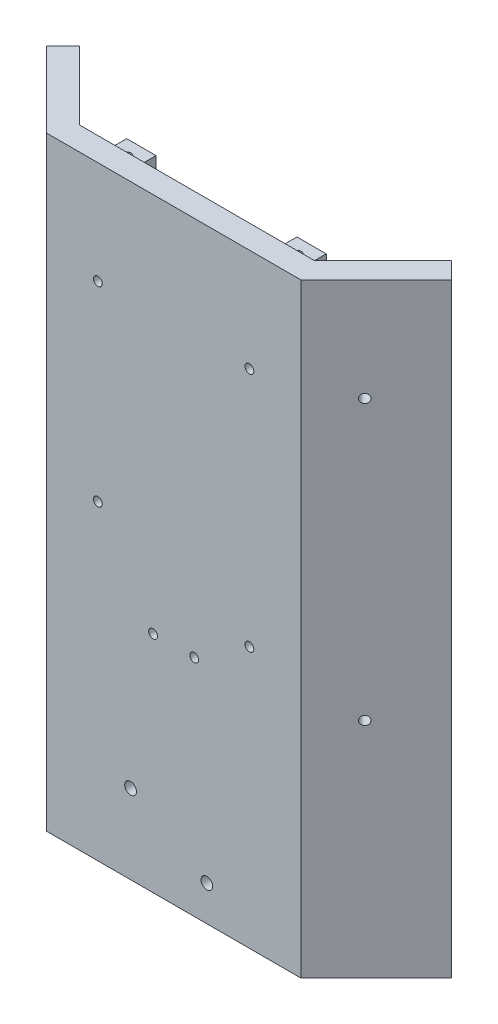
from build123d import *

# Parameters (mm, degrees)
BOSS_EXTRUDE1_DEPTH = 206
SKETCH2_W           = 10
SKETCH2_H           = 6
BOSS_EXTRUDE2_DEPTH = 10
CUT_EXTRUDE1_REACH  = 214.848
SKETCH3_R           = 1.5
CUT_EXTRUDE2_REACH  = 221.494
SKETCH4_R           = 2
CUT_EXTRUDE3_REACH  = 221.494
SKETCH5_R           = 1.5
CUT_EXTRUDE4_REACH  = 221.494
SKETCH6_R           = 1.5
CUT_EXTRUDE5_REACH  = 233.936
SKETCH7_R           = 1.5
CUT_EXTRUDE6_REACH  = 233.936
SKETCH8_R           = 1.5


with BuildPart() as part:
    # Sketch1 → Boss-Extrude1 (new body)
    with BuildSketch(Plane(origin=(0, 0, 0), x_dir=(1, 0, 0), z_dir=(0, 1, 0))):
        Polygon((-40, 0), (40, 0), (63.334523779, 23.334523779), (68.991378029, 17.67766953), (43.313708499, -8), (-43.313708499, -8), (-68.991378029, 17.67766953), (-63.334523779, 23.334523779), align=None)
    extrude(amount=BOSS_EXTRUDE1_DEPTH)

    # Sketch2 → Boss-Extrude2 (add)
    with BuildSketch(Plane(origin=(0, 0, 0), x_dir=(-1, 0, 0), z_dir=(0, 0, -1))):
        with Locations((-29, 197)):
            Rectangle(SKETCH2_W, SKETCH2_H)
        with Locations((29, 197)):
            Rectangle(SKETCH2_W, SKETCH2_H)
    extrude(amount=BOSS_EXTRUDE2_DEPTH)

    # Sketch3 → Cut-Extrude1 (cut, up to next)
    with BuildSketch(Plane(origin=(0, 200, 0), x_dir=(1, 0, 0), z_dir=(0, 1, 0)), mode=Mode.PRIVATE) as cut_extrude1_sk1:
        with Locations(Location((-29, 5, 0), (0, 0, 180))):
            Circle(SKETCH3_R)
    cut_extrude1_tool1 = extrude(cut_extrude1_sk1.sketch, amount=-CUT_EXTRUDE1_REACH, mode=Mode.PRIVATE) & part.part
    # Sketch3 → Cut-Extrude1 (cut, up to next)
    with BuildSketch(Plane(origin=(0, 200, 0), x_dir=(1, 0, 0), z_dir=(0, 1, 0)), mode=Mode.PRIVATE) as cut_extrude1_sk2:
        with Locations(Location((29, 5, 0), (0, 0, 180))):
            Circle(SKETCH3_R)
    cut_extrude1_tool2 = extrude(cut_extrude1_sk2.sketch, amount=-CUT_EXTRUDE1_REACH, mode=Mode.PRIVATE) & part.part
    add(cut_extrude1_tool1.solids().sort_by_distance((-29, 200, -5))[0], mode=Mode.SUBTRACT)
    add(cut_extrude1_tool2.solids().sort_by_distance((29, 200, -5))[0], mode=Mode.SUBTRACT)

    # Sketch4 → Cut-Extrude2 (cut, up to next)
    with BuildSketch(Plane.XY.offset(8), mode=Mode.PRIVATE) as cut_extrude2_sk1:
        with Locations((-14.667053615, 27)):
            Circle(SKETCH4_R)
    cut_extrude2_tool1 = extrude(cut_extrude2_sk1.sketch, amount=-CUT_EXTRUDE2_REACH, mode=Mode.PRIVATE) & part.part
    # Sketch4 → Cut-Extrude2 (cut, up to next)
    with BuildSketch(Plane.XY.offset(8), mode=Mode.PRIVATE) as cut_extrude2_sk2:
        with Locations((11.313708499, 12)):
            Circle(SKETCH4_R)
    cut_extrude2_tool2 = extrude(cut_extrude2_sk2.sketch, amount=-CUT_EXTRUDE2_REACH, mode=Mode.PRIVATE) & part.part
    add(cut_extrude2_tool1.solids().sort_by_distance((-14.667054, 27, 8))[0], mode=Mode.SUBTRACT)
    add(cut_extrude2_tool2.solids().sort_by_distance((11.313708, 12, 8))[0], mode=Mode.SUBTRACT)

    # Sketch5 → Cut-Extrude3 (cut, up to next)
    with BuildSketch(Plane.XY.offset(8), mode=Mode.PRIVATE) as cut_extrude3_sk1:
        with Locations((-7, 76.404082058)):
            Circle(SKETCH5_R)
    cut_extrude3_tool1 = extrude(cut_extrude3_sk1.sketch, amount=-CUT_EXTRUDE3_REACH, mode=Mode.PRIVATE) & part.part
    # Sketch5 → Cut-Extrude3 (cut, up to next)
    with BuildSketch(Plane.XY.offset(8), mode=Mode.PRIVATE) as cut_extrude3_sk2:
        with Locations((7, 76.404082058)):
            Circle(SKETCH5_R)
    cut_extrude3_tool2 = extrude(cut_extrude3_sk2.sketch, amount=-CUT_EXTRUDE3_REACH, mode=Mode.PRIVATE) & part.part
    add(cut_extrude3_tool1.solids().sort_by_distance((-7, 76.404082, 8))[0], mode=Mode.SUBTRACT)
    add(cut_extrude3_tool2.solids().sort_by_distance((7, 76.404082, 8))[0], mode=Mode.SUBTRACT)

    # Sketch6 → Cut-Extrude4 (cut, up to next)
    with BuildSketch(Plane.XY.offset(8), mode=Mode.PRIVATE) as cut_extrude4_sk1:
        with Locations((-25.813708499, 171)):
            Circle(SKETCH6_R)
    cut_extrude4_tool1 = extrude(cut_extrude4_sk1.sketch, amount=-CUT_EXTRUDE4_REACH, mode=Mode.PRIVATE) & part.part
    # Sketch6 → Cut-Extrude4 (cut, up to next)
    with BuildSketch(Plane.XY.offset(8), mode=Mode.PRIVATE) as cut_extrude4_sk2:
        with Locations((25.813708499, 171)):
            Circle(SKETCH6_R)
    cut_extrude4_tool2 = extrude(cut_extrude4_sk2.sketch, amount=-CUT_EXTRUDE4_REACH, mode=Mode.PRIVATE) & part.part
    # Sketch6 → Cut-Extrude4 (cut, up to next)
    with BuildSketch(Plane.XY.offset(8), mode=Mode.PRIVATE) as cut_extrude4_sk3:
        with Locations((-25.813708499, 106)):
            Circle(SKETCH6_R)
    cut_extrude4_tool3 = extrude(cut_extrude4_sk3.sketch, amount=-CUT_EXTRUDE4_REACH, mode=Mode.PRIVATE) & part.part
    # Sketch6 → Cut-Extrude4 (cut, up to next)
    with BuildSketch(Plane.XY.offset(8), mode=Mode.PRIVATE) as cut_extrude4_sk4:
        with Locations((25.813708499, 89)):
            Circle(SKETCH6_R)
    cut_extrude4_tool4 = extrude(cut_extrude4_sk4.sketch, amount=-CUT_EXTRUDE4_REACH, mode=Mode.PRIVATE) & part.part
    add(cut_extrude4_tool1.solids().sort_by_distance((-25.813708, 171, 8))[0], mode=Mode.SUBTRACT)
    add(cut_extrude4_tool2.solids().sort_by_distance((25.813708, 171, 8))[0], mode=Mode.SUBTRACT)
    add(cut_extrude4_tool3.solids().sort_by_distance((-25.813708, 106, 8))[0], mode=Mode.SUBTRACT)
    add(cut_extrude4_tool4.solids().sort_by_distance((25.813708, 89, 8))[0], mode=Mode.SUBTRACT)

    # Sketch7 → Cut-Extrude5 (cut, up to next)
    with BuildSketch(Plane(origin=(-25.656854249, 0, 25.656854249), x_dir=(0.707106781186551, 0, 0.7071067811865441), z_dir=(-0.7071067811865441, 0, 0.707106781186551)), mode=Mode.PRIVATE) as cut_extrude5_sk1:
        with Locations((-43.414271247, 171)):
            Circle(SKETCH7_R)
    cut_extrude5_tool1 = extrude(cut_extrude5_sk1.sketch, amount=-CUT_EXTRUDE5_REACH, mode=Mode.PRIVATE) & part.part
    # Sketch7 → Cut-Extrude5 (cut, up to next)
    with BuildSketch(Plane(origin=(-25.656854249, 0, 25.656854249), x_dir=(0.707106781186551, 0, 0.7071067811865441), z_dir=(-0.7071067811865441, 0, 0.707106781186551)), mode=Mode.PRIVATE) as cut_extrude5_sk2:
        with Locations((-43.414271247, 81)):
            Circle(SKETCH7_R)
    cut_extrude5_tool2 = extrude(cut_extrude5_sk2.sketch, amount=-CUT_EXTRUDE5_REACH, mode=Mode.PRIVATE) & part.part
    add(cut_extrude5_tool1.solids().sort_by_distance((-56.35538, 171, -5.041671))[0], mode=Mode.SUBTRACT)
    add(cut_extrude5_tool2.solids().sort_by_distance((-56.35538, 81, -5.041671))[0], mode=Mode.SUBTRACT)

    # Sketch8 → Cut-Extrude6 (cut, up to next)
    with BuildSketch(Plane(origin=(25.656854249, 0, 25.656854249), x_dir=(0.7071067811865462, 0, -0.7071067811865489), z_dir=(0.7071067811865489, 0, 0.7071067811865462)), mode=Mode.PRIVATE) as cut_extrude6_sk1:
        with Locations((40.384271247, 171)):
            Circle(SKETCH8_R)
    cut_extrude6_tool1 = extrude(cut_extrude6_sk1.sketch, amount=-CUT_EXTRUDE6_REACH, mode=Mode.PRIVATE) & part.part
    # Sketch8 → Cut-Extrude6 (cut, up to next)
    with BuildSketch(Plane(origin=(25.656854249, 0, 25.656854249), x_dir=(0.7071067811865462, 0, -0.7071067811865489), z_dir=(0.7071067811865489, 0, 0.7071067811865462)), mode=Mode.PRIVATE) as cut_extrude6_sk2:
        with Locations((40.384271247, 76)):
            Circle(SKETCH8_R)
    cut_extrude6_tool2 = extrude(cut_extrude6_sk2.sketch, amount=-CUT_EXTRUDE6_REACH, mode=Mode.PRIVATE) & part.part
    add(cut_extrude6_tool1.solids().sort_by_distance((54.212846, 171, -2.899138))[0], mode=Mode.SUBTRACT)
    add(cut_extrude6_tool2.solids().sort_by_distance((54.212846, 76, -2.899138))[0], mode=Mode.SUBTRACT)


solid = part.part
